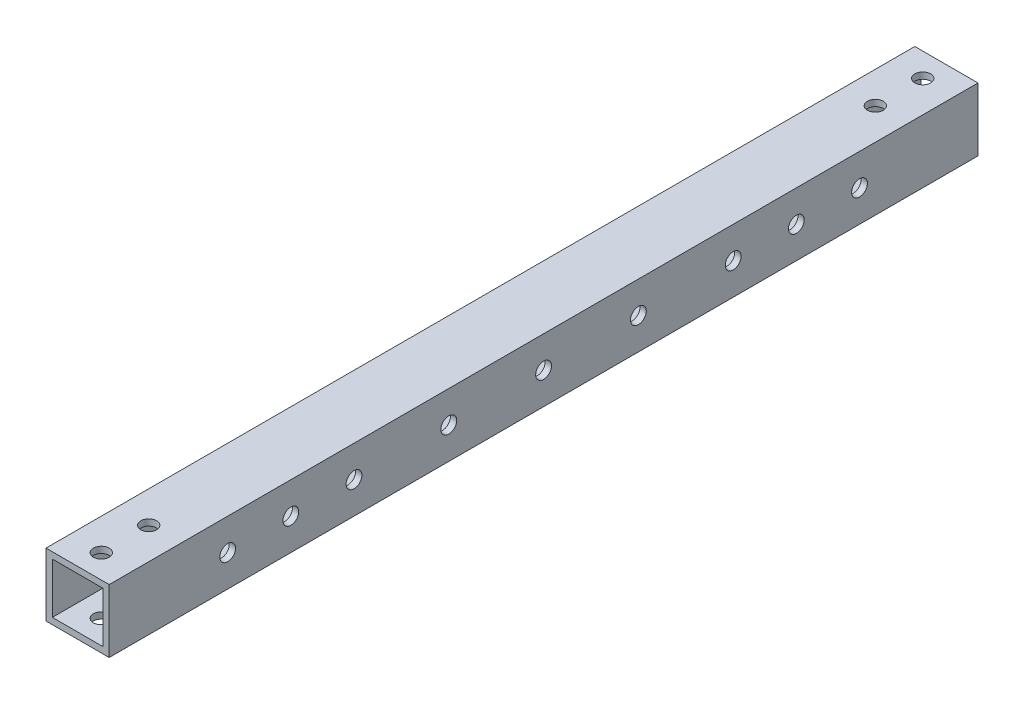
from build123d import *

# Parameters (mm, degrees)
SKETCH_1_W          = 20
SKETCH_1_H          = 20
SKETCH_1_W_2        = 16
SKETCH_1_H_2        = 16
EXTRUDE_1_DEPTH     = 275
SKETCH_4_R          = 2.5
CUT_EXTRUDE_3_DEPTH = 84
SKETCH_5_R          = 2.5
CUT_EXTRUDE_4_DEPTH = 276.907593226
SKETCH_6_R          = 2.5
CUT_EXTRUDE_5_DEPTH = 20


with BuildPart() as part:
    # 草图1 → 凸台-拉伸1 (new body)
    with BuildSketch(Plane.XY):
        Rectangle(SKETCH_1_W, SKETCH_1_H)
        Rectangle(SKETCH_1_W_2, SKETCH_1_H_2, mode=Mode.SUBTRACT)
    extrude(amount=EXTRUDE_1_DEPTH)

    # 草图4 → 切除-拉伸3 (cut)
    with BuildSketch(Plane.ZY.offset(10)):
        with Locations(Location((107.5, 0, 0), (0, 0, 270))):
            Circle(SKETCH_4_R)
        with Locations(Location((167.5, 0, 0), (0, 0, 270))):
            Circle(SKETCH_4_R)
        with Locations(Location((137.5, 0, 0), (0, 0, 270))):
            Circle(SKETCH_4_R)
    extrude(amount=-CUT_EXTRUDE_3_DEPTH, mode=Mode.SUBTRACT)

    # 草图5 → 切除-拉伸4 (cut, through all)
    with BuildSketch(Plane(origin=(10, 0, 0), x_dir=(0, 0, -1), z_dir=(1, 0, 0))):
        with Locations((-77.5, 0)):
            Circle(SKETCH_5_R)
        with Locations((-57.5, 0)):
            Circle(SKETCH_5_R)
        with Locations((-37.5, 0)):
            Circle(SKETCH_5_R)
        with Locations(Location((-237.5, 0, 0), (0, 0, 90))):
            Circle(SKETCH_5_R)
        with Locations(Location((-217.5, 0, 0), (0, 0, 90))):
            Circle(SKETCH_5_R)
        with Locations(Location((-197.5, 0, 0), (0, 0, 90))):
            Circle(SKETCH_5_R)
    extrude(amount=-CUT_EXTRUDE_4_DEPTH, mode=Mode.SUBTRACT)

    # 草图6 → 切除-拉伸5 (cut)
    with BuildSketch(Plane(origin=(0, 10, 0), x_dir=(1, 0, 0), z_dir=(0, 1, 0))):
        with Locations(Location((0, -267.5, 0), (0, 0, 270))):
            Circle(SKETCH_6_R)
        with Locations(Location((0, -252.5, 0), (0, 0, 270))):
            Circle(SKETCH_6_R)
        with Locations(Location((0, -22.5, 0), (0, 0, 270))):
            Circle(SKETCH_6_R)
        with Locations(Location((0, -7.5, 0), (0, 0, 270))):
            Circle(SKETCH_6_R)
    extrude(amount=-CUT_EXTRUDE_5_DEPTH, mode=Mode.SUBTRACT)


solid = part.part
